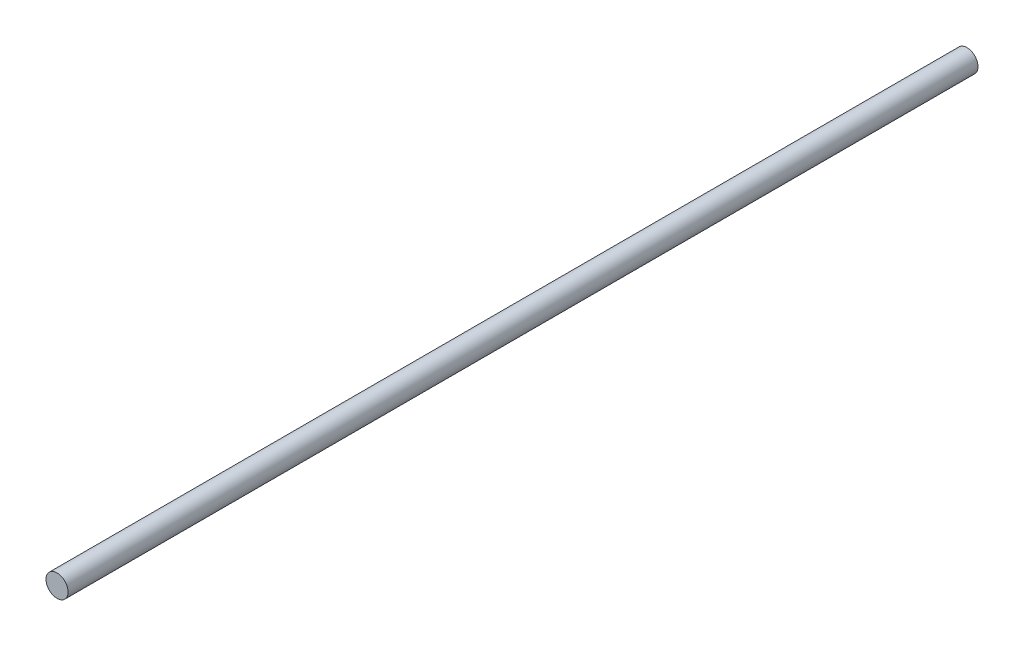
from build123d import *

# Parameters (mm, degrees)
SKETCH_1_W = 3.75
SKETCH_1_H = 309


with BuildPart() as part:
    # Эскиз1 → Повернуть1 (revolve)
    with BuildSketch(Plane(origin=(0, 0, 0), x_dir=(1, 0, 0), z_dir=(0, 1, 0))):
        with Locations((1.875, -154.5)):
            Rectangle(SKETCH_1_W, SKETCH_1_H)
    revolve(axis=Axis((0, 0, 0), (0, 0, 1)))


solid = part.part
